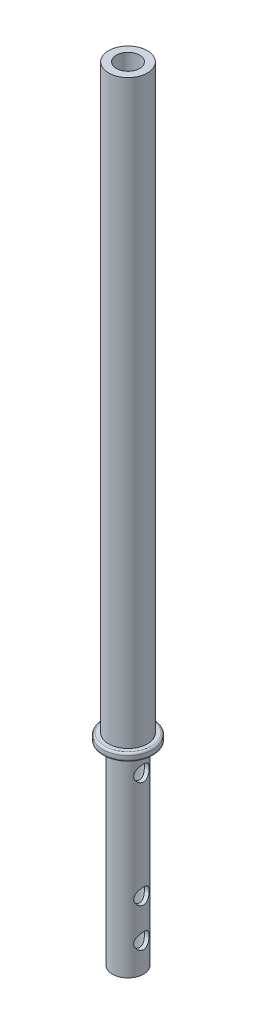
from build123d import *

# Parameters (mm, degrees)
SKETCH2_R               = 6
CUT_EXTRUDE1_DEPTH      = 405.418100485
CUT_EXTRUDE3_DEPTH      = 301.562805417
CUT_EXTRUDE3_DEPTH_BACK = 301.562805417
SKETCH3_R               = 4
FILLET1_R               = 1


with BuildPart() as part:
    # Sketch1 → Revolve1 (revolve)
    with BuildSketch(Plane(origin=(0, 0, 0), x_dir=(0, 0, -1), z_dir=(1, 0, 0))):
        Polygon((0, 0), (0, 300), (10, 300), (10, 0), (13, 0), (13, -4), (8, -4), (8, -104), (0, -104), align=None)
    revolve(axis=Axis((0, 0, 0), (0, 1, 0)))

    # Sketch2 → Cut-Extrude1 (cut, through all)
    with BuildSketch(Plane(origin=(0, 300, 0), x_dir=(1, 0, 0), z_dir=(0, 1, 0))):
        with Locations(Location((0, 0, 0), (0, 0, 270))):
            Circle(SKETCH2_R)
    extrude(amount=-CUT_EXTRUDE1_DEPTH, mode=Mode.SUBTRACT)

    # Sketch3 → Cut-Extrude3 (cut, two sides: drawn at the far end of the back side and taken through both)
    with BuildSketch(Plane(origin=(0, 0, 0), x_dir=(0, 0, -1), z_dir=(1, 0, 0)).offset(-CUT_EXTRUDE3_DEPTH_BACK)):
        with Locations((0, -14)):
            Circle(SKETCH3_R)
        with Locations((0, -69)):
            Circle(SKETCH3_R)
        with Locations((0, -89)):
            Circle(SKETCH3_R)
    extrude(amount=CUT_EXTRUDE3_DEPTH + CUT_EXTRUDE3_DEPTH_BACK, mode=Mode.SUBTRACT)

    # Fillet1
    fillet1_edges = [part.edges().sort_by_distance(p)[0] for p in [
        (0, -4, 13),
        (0, 0, 13),
    ]]
    fillet(fillet1_edges, radius=FILLET1_R)


solid = part.part
